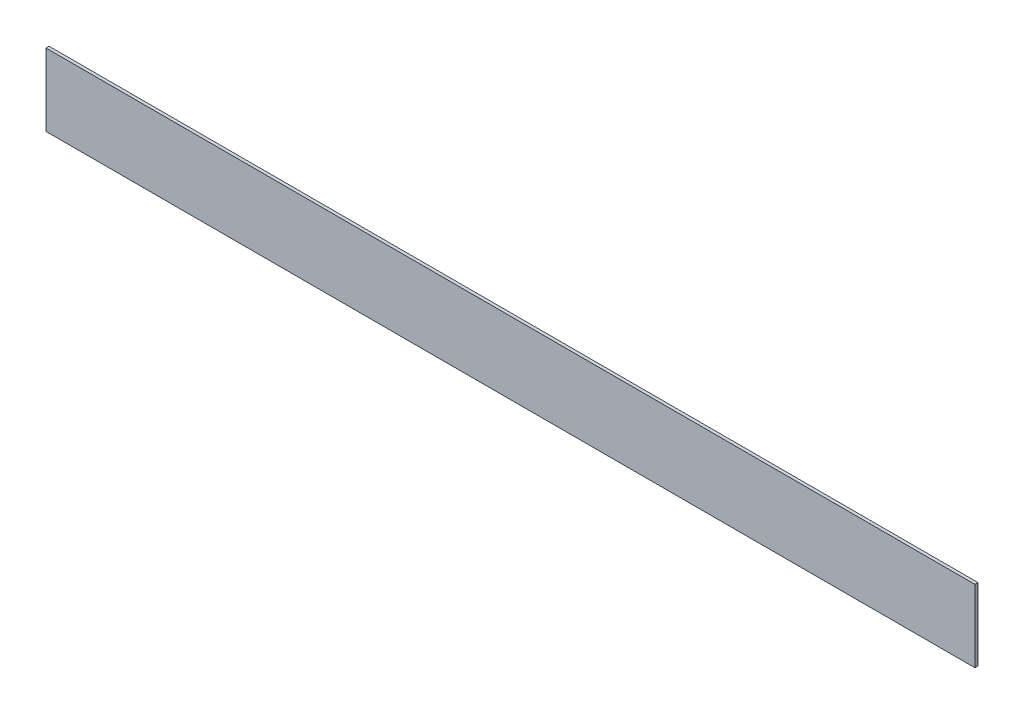
from build123d import *

# Parameters (mm, degrees)
ESQUISSE1_W        = 450
ESQUISSE1_H        = 35
BOSS_EXTRU_1_DEPTH = 1.5


with BuildPart() as part:
    # Esquisse1 → Boss.-Extru.1 (new body)
    with BuildSketch(Plane.XY):
        with Locations((22.04610951, 15.893371758)):
            Rectangle(ESQUISSE1_W, ESQUISSE1_H)
    extrude(amount=BOSS_EXTRU_1_DEPTH)


solid = part.part
